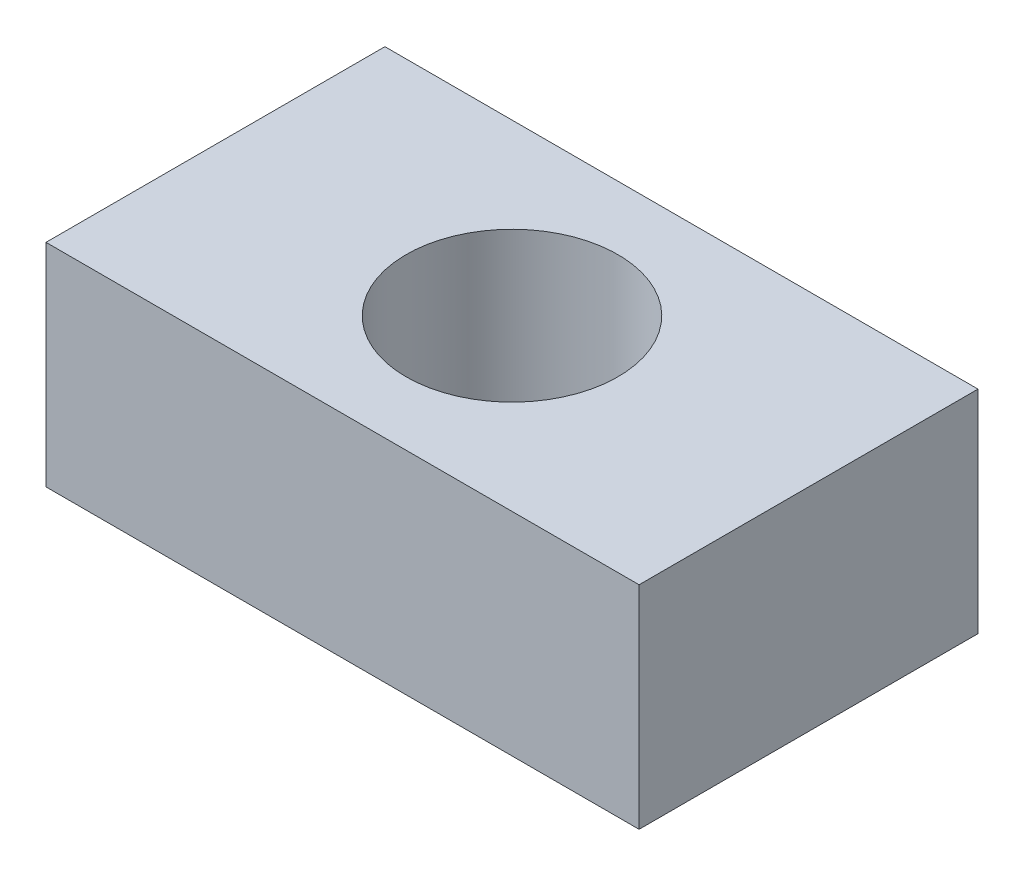
from build123d import *

# Parameters (mm, degrees)
SKETCH1_W           = 14
SKETCH1_H           = 8
SKETCH1_R           = 2.5
BOSS_EXTRUDE1_DEPTH = 2.5


with BuildPart() as part:
    # Sketch1 → Boss-Extrude1 (new, symmetric)
    with BuildSketch(Plane(origin=(0, 0, 0), x_dir=(1, 0, 0), z_dir=(0, 1, 0))):
        Rectangle(SKETCH1_W, SKETCH1_H)
        with Locations(Location((0, 0, 0), (0, 0, 270))):
            Circle(SKETCH1_R, mode=Mode.SUBTRACT)
    extrude(amount=BOSS_EXTRUDE1_DEPTH, both=True)


solid = part.part
